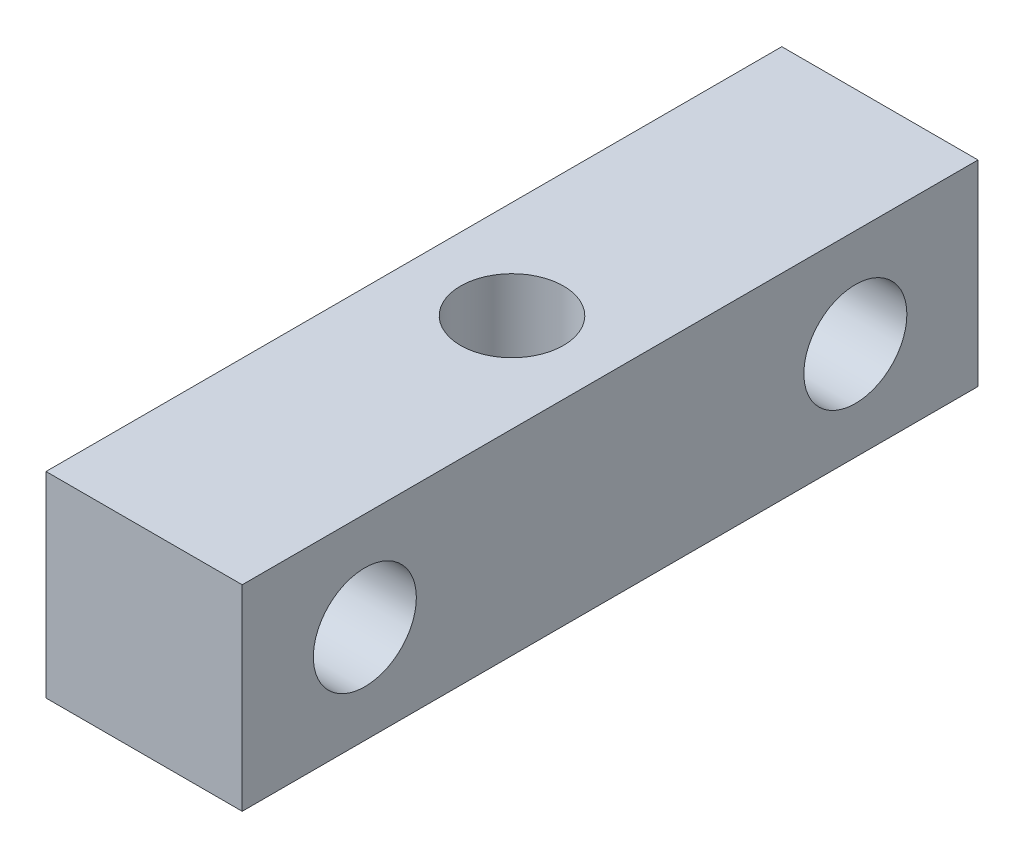
from build123d import *

# Parameters (mm, degrees)
SKETCH_2_W          = 8
SKETCH_2_H          = 8
EXTRUDE_1_DEPTH     = 30
SKETCH_3_R          = 2.1
CUT_EXTRUDE_1_DEPTH = 32.304951685
SKETCH_4_R          = 2.1
CUT_EXTRUDE_2_DEPTH = 32.304951685


with BuildPart() as part:
    # 草图2 → 凸台-拉伸1 (new body)
    with BuildSketch(Plane.XY):
        Rectangle(SKETCH_2_W, SKETCH_2_H)
    extrude(amount=EXTRUDE_1_DEPTH)

    # 草图3 → 切除-拉伸1 (cut, through all)
    with BuildSketch(Plane(origin=(0, 4, 0), x_dir=(1, 0, 0), z_dir=(0, 1, 0))):
        with Locations(Location((0, -15, 0), (0, 0, 270))):
            Circle(SKETCH_3_R)
    extrude(amount=-CUT_EXTRUDE_1_DEPTH, mode=Mode.SUBTRACT)

    # 草图4 → 切除-拉伸2 (cut, through all)
    with BuildSketch(Plane(origin=(4, 0, 0), x_dir=(0, 0, -1), z_dir=(1, 0, 0))):
        with Locations((-25, 0)):
            Circle(SKETCH_4_R)
        with Locations((-5, 0)):
            Circle(SKETCH_4_R)
    extrude(amount=-CUT_EXTRUDE_2_DEPTH, mode=Mode.SUBTRACT)


solid = part.part
